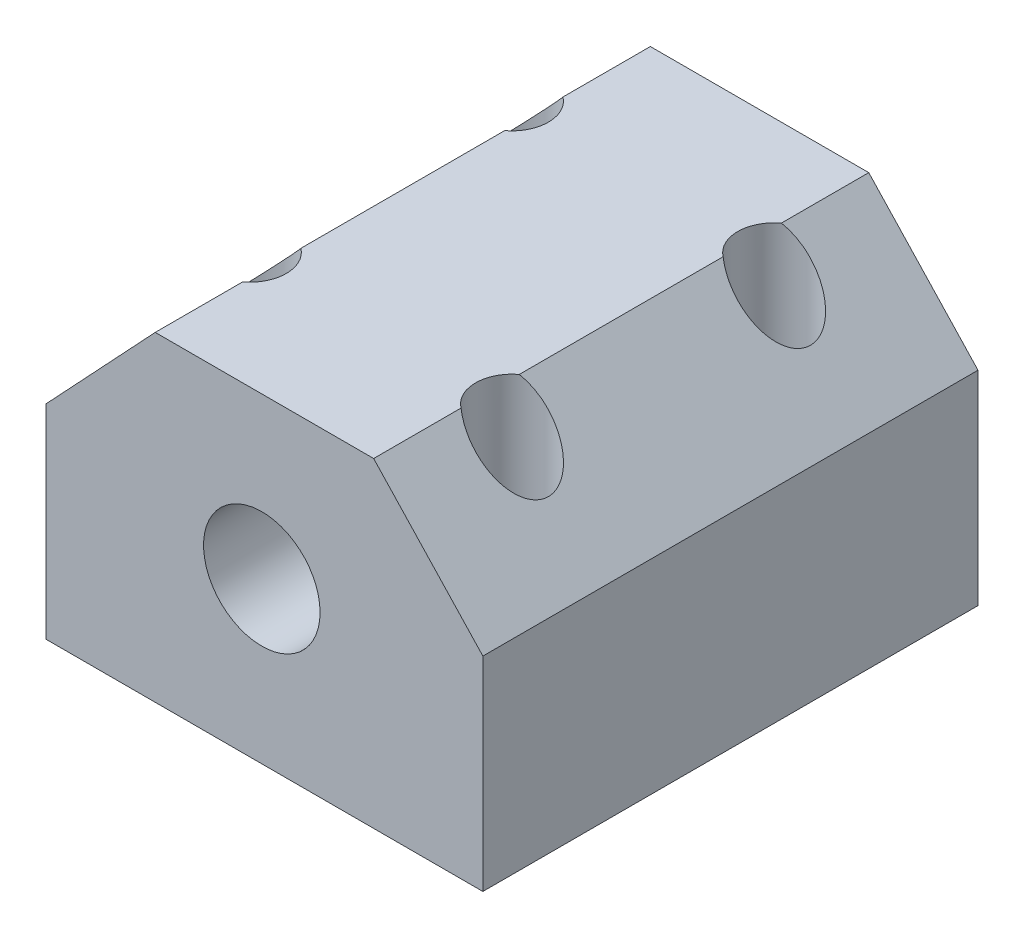
from build123d import *

# Parameters (mm, degrees)
SKETCH1_W           = 30
SKETCH1_H           = 34
BOSS_EXTRUDE1_DEPTH = 22
CUT_EXTRUDE1_REACH  = 52.398
SKETCH2_R           = 4
SKETCH3_R           = 2.5
CUT_EXTRUDE2_DEPTH  = 22


with BuildPart() as part:
    # Sketch1 → Boss-Extrude1 (new body)
    with BuildSketch(Plane(origin=(0, 0, 0), x_dir=(1, 0, 0), z_dir=(0, 1, 0))):
        with Locations((15, 17)):
            Rectangle(SKETCH1_W, SKETCH1_H)
    extrude(amount=BOSS_EXTRUDE1_DEPTH)

    # Sketch2 → Cut-Extrude1 (cut, up to next)
    with BuildSketch(Plane.XY, mode=Mode.PRIVATE) as cut_extrude1_sk1:
        with Locations((14.820555819, 11)):
            Circle(SKETCH2_R)
    cut_extrude1_tool1 = extrude(cut_extrude1_sk1.sketch, amount=-CUT_EXTRUDE1_REACH, mode=Mode.PRIVATE) & part.part
    # Sketch2 → Cut-Extrude1 (cut, up to next)
    with BuildSketch(Plane.XY, mode=Mode.PRIVATE) as cut_extrude1_sk2:
        Polygon((0, 14), (7.5, 22), (0, 22), align=None)
    cut_extrude1_tool2 = extrude(cut_extrude1_sk2.sketch, amount=-CUT_EXTRUDE1_REACH, mode=Mode.PRIVATE) & part.part
    # Sketch2 → Cut-Extrude1 (cut, up to next)
    with BuildSketch(Plane.XY, mode=Mode.PRIVATE) as cut_extrude1_sk3:
        Polygon((30, 14), (22.5, 22), (30, 22), align=None)
    cut_extrude1_tool3 = extrude(cut_extrude1_sk3.sketch, amount=-CUT_EXTRUDE1_REACH, mode=Mode.PRIVATE) & part.part
    add(cut_extrude1_tool1.solids().sort_by_distance((14.820556, 11, 0))[0], mode=Mode.SUBTRACT)
    add(cut_extrude1_tool2.solids().sort_by_distance((2.5, 19.333333, 0))[0], mode=Mode.SUBTRACT)
    add(cut_extrude1_tool3.solids().sort_by_distance((27.5, 19.333333, 0))[0], mode=Mode.SUBTRACT)

    # Sketch3 → Cut-Extrude2 (cut)
    with BuildSketch(Plane.XZ):
        with Locations(Location((6, -8, 0), (0, 0, 270))):
            Circle(SKETCH3_R)
        with Locations(Location((24, -8, 0), (0, 0, 270))):
            Circle(SKETCH3_R)
        with Locations(Location((24, -26, 0), (0, 0, 270))):
            Circle(SKETCH3_R)
        with Locations(Location((6, -26, 0), (0, 0, 270))):
            Circle(SKETCH3_R)
    extrude(amount=-CUT_EXTRUDE2_DEPTH, mode=Mode.SUBTRACT)


solid = part.part
